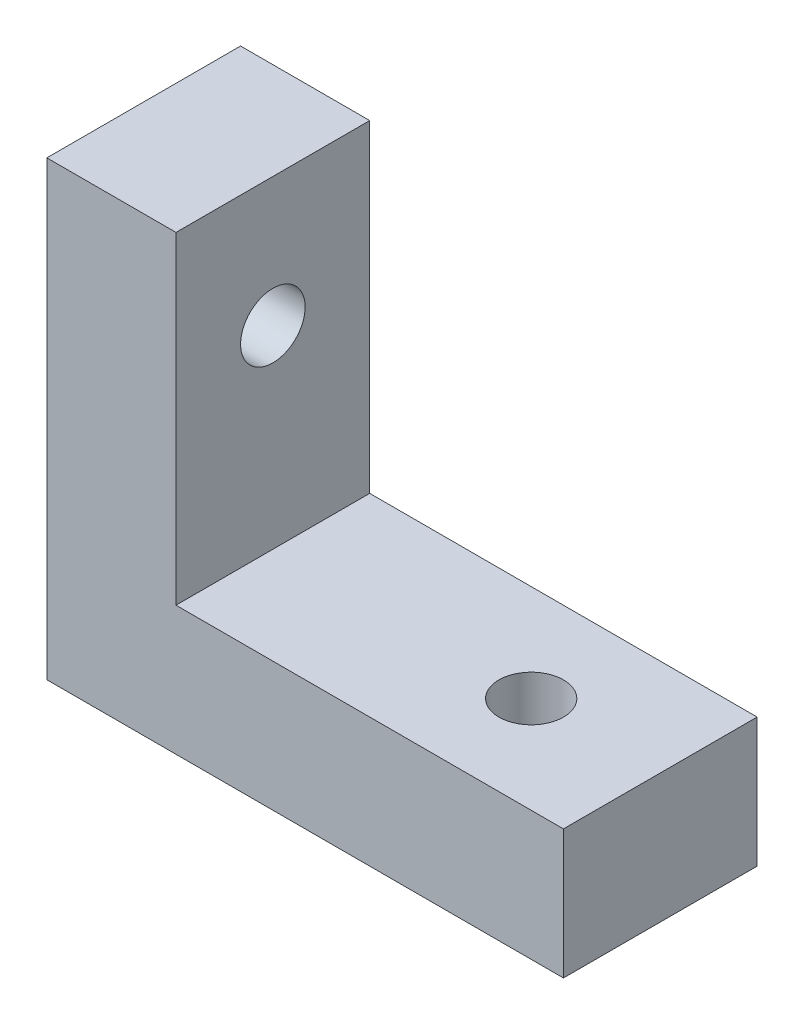
from build123d import *

# Parameters (mm, degrees)
SKETCH1_W           = 80
SKETCH1_H           = 30
BOSS_EXTRUDE2_DEPTH = 20
SKETCH4_W           = 20
SKETCH4_H           = 30
BOSS_EXTRUDE3_DEPTH = 50
SKETCH6_R           = 5
CUT_EXTRUDE2_DEPTH  = 50
SKETCH7_R           = 5
CUT_EXTRUDE4_DEPTH  = 50


with BuildPart() as part:
    # Sketch1 → Boss-Extrude2 (new body)
    with BuildSketch(Plane(origin=(0, 0, 0), x_dir=(1, 0, 0), z_dir=(0, 1, 0))):
        with Locations((40, 15)):
            Rectangle(SKETCH1_W, SKETCH1_H)
    extrude(amount=BOSS_EXTRUDE2_DEPTH)

    # Sketch4 → Boss-Extrude3 (add)
    with BuildSketch(Plane(origin=(0, 20, 0), x_dir=(1, 0, 0), z_dir=(0, 1, 0))):
        with Locations((10, 15)):
            Rectangle(SKETCH4_W, SKETCH4_H)
    extrude(amount=BOSS_EXTRUDE3_DEPTH)

    # Sketch6 → Cut-Extrude2 (cut)
    with BuildSketch(Plane(origin=(0, 20, 0), x_dir=(1, 0, 0), z_dir=(0, 1, 0))):
        with Locations(Location((60.018182297, 14.993207378, 0), (0, 0, 270))):
            Circle(SKETCH6_R)
    extrude(amount=-CUT_EXTRUDE2_DEPTH, mode=Mode.SUBTRACT)

    # Sketch7 → Cut-Extrude4 (cut)
    with BuildSketch(Plane(origin=(20, 0, 0), x_dir=(0, 0, -1), z_dir=(1, 0, 0))):
        with Locations((15, 50)):
            Circle(SKETCH7_R)
    extrude(amount=-CUT_EXTRUDE4_DEPTH, mode=Mode.SUBTRACT)


solid = part.part
